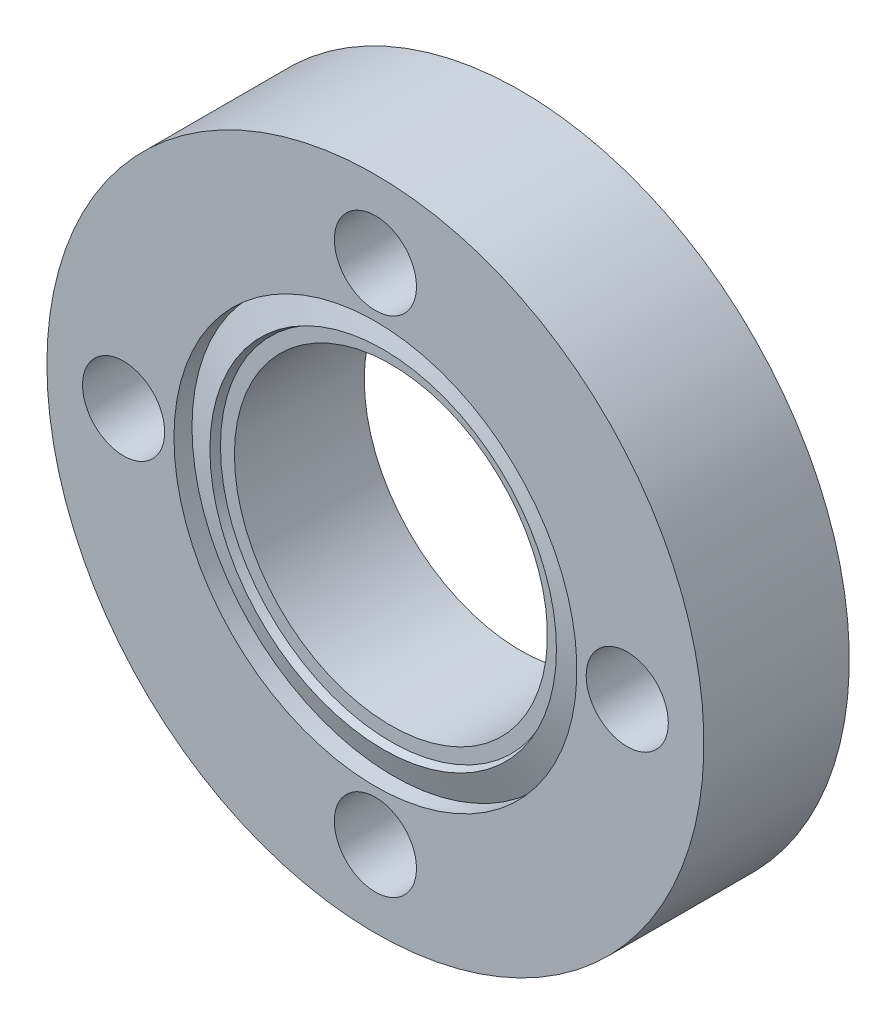
from build123d import *

# Parameters (mm, degrees)
SKETCH2_R          = 3.3655
CUT_EXTRUDE1_DEPTH = 19.05
CIRPATTERN1_COUNT  = 4


with BuildPart() as part:
    # Sketch1 → Revolve1 (revolve)
    with BuildSketch(Plane(origin=(0, 0, 0), x_dir=(0, 0, -1), z_dir=(1, 0, 0)), mode=Mode.PRIVATE) as revolve1_sk:
        Polygon((-1.27, 26.924), (10.6426, 26.924), (10.6426, 12.827), (0, 12.827), (0, 13.97), (-0.635, 14.201121099), (0.205363195, 16.51), (-1.27, 16.51), align=None)
    revolve(revolve1_sk.sketch.rotate(Axis((0, 0, 0), (0, 0, 1)), 90), axis=Axis((0, 0, 0), (0, 0, 1)))

    # Sketch2 → Cut-Extrude1 (cut, symmetric)
    with BuildSketch(Plane.XY):
        with Locations(Location((0, 20.6375, 0), (0, 0, 180))):
            Circle(SKETCH2_R)
    cut_extrude1 = extrude(amount=CUT_EXTRUDE1_DEPTH, both=True, mode=Mode.SUBTRACT)

    # CirPattern1: Cut-Extrude1 ×4 about axis
    cirpattern1_axis = Axis((0, 0, 0), (0, 0, 1))
    for i in range(1, CIRPATTERN1_COUNT):
        add(cut_extrude1.rotate(cirpattern1_axis, i * 360 / CIRPATTERN1_COUNT), mode=Mode.SUBTRACT)


solid = part.part
